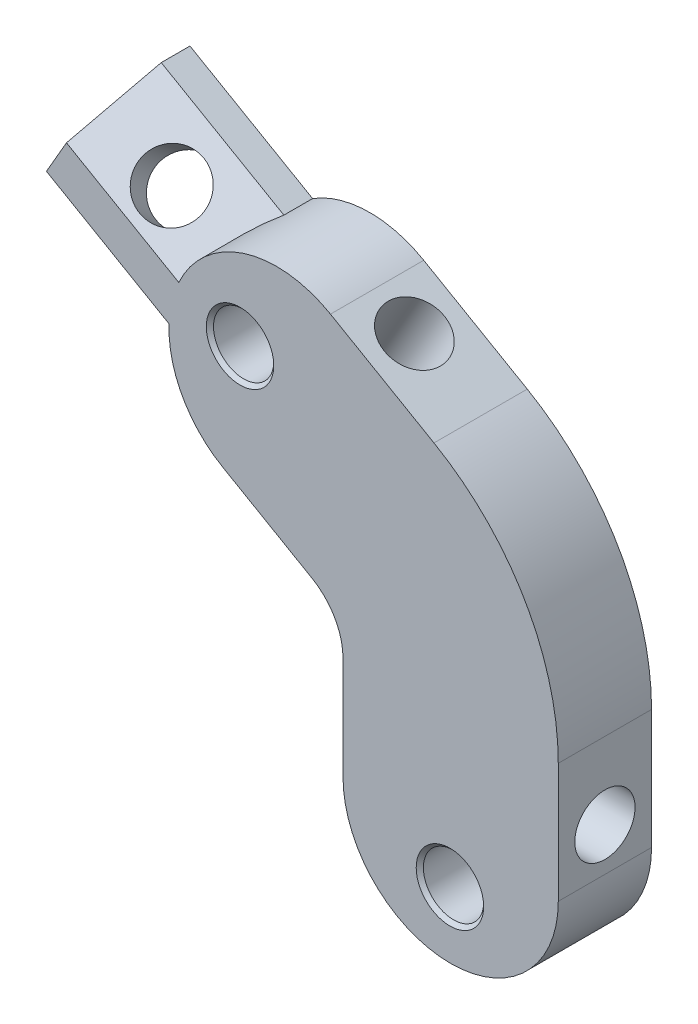
from build123d import *

# Parameters (mm, degrees)
BOSS_EXTRUDE1_DEPTH        = 13
CUT_EXTRUDE1_DEPTH         = 71.771362109
CUT_EXTRUDE2_DEPTH         = 62.040693778
F_8_4_8_4_DIAMETER_HOLE1_D = 8.4
CHAMFER2_SIZE              = 9
CHAMFER2_SIZE2             = 8.410167494
CHAMFER3_SIZE              = 8
CHAMFER3_SIZE2             = 8.56106612
SKETCH11_R                 = 4.2
CUT_EXTRUDE5_DEPTH         = 10
CHAMFER4_SIZE              = 0.5
SKETCH12_W                 = 893.834484117
SKETCH12_H                 = 134.722779032
CUT_EXTRUDE6_DEPTH         = 73.047156948


with BuildPart() as part:
    # Sketch1 → Boss-Extrude1 (new body)
    with BuildSketch(Plane(origin=(0, 0, 0), x_dir=(-1, 0, 0), z_dir=(0, 0, -1))):
        with BuildLine():
            Line((-14.999999535, -11.339745693), (-14.999999535, -27.999999731))
            ThreePointArc((-14.999999535, -27.999999731), (4.65e-07, -42.999999731), (15.000000465, -27.999999731))
            Line((15.000000465, -27.999999731), (15.000000465, -13.660253769))
            ThreePointArc((15.000000465, -13.660253769), (16.160254503, -9.33012675), (19.330127484, -6.160253769))
            Line((19.330127484, -6.160253769), (31.748711306, 1.009618943))
            ThreePointArc((31.748711306, 1.009618943), (37.239092363, 6.5), (39.248711306, 14))
            ThreePointArc((39.248711306, 14), (39.245992383, 14.285587643), (39.237836599, 14.571071754))
            Line((39.237836599, 14.571071754), (56.327549631, 24.437822174))
            Line((56.327549631, 24.437822174), (52.827549631, 30.5))
            Line((52.827549631, 30.5), (49.327549631, 36.562177826))
            Line((49.327549631, 36.562177826), (32.237836599, 26.695427407))
            ThreePointArc((32.237836599, 26.695427407), (31.994677998, 26.845232579), (31.748711306, 26.990381057))
            ThreePointArc((31.748711306, 26.990381057), (24.248711306, 29), (16.748711306, 26.990381057))
            Line((16.748711306, 26.990381057), (2.320508541, 18.660254307))
            ThreePointArc((2.320508541, 18.660254307), (-10.358983383, 5.980762382), (-14.999999535, -11.339745693))
        make_face()
    extrude(amount=-BOSS_EXTRUDE1_DEPTH)

    # Sketch2 → Cut-Extrude1 (cut, through all)
    with BuildSketch(Plane(origin=(-7.5, -12.990381057, 0), x_dir=(0.8660254037844388, -0.4999999999999997, 0), z_dir=(-0.4999999999999997, -0.8660254037844388, 0))):
        with BuildLine():
            ThreePointArc((-25.021227161, 9.417565156), (-22, 2.3), (-18.978772839, 9.417565156))
            ThreePointArc((-18.978772839, 9.417565156), (-22, 10.7), (-25.021227161, 9.417565156))
        make_face()
    extrude(amount=-CUT_EXTRUDE1_DEPTH, mode=Mode.SUBTRACT)

    # Sketch3 → Cut-Extrude2 (cut, through all)
    with BuildSketch(Plane.ZY.offset(15.000000465)):
        with BuildLine():
            ThreePointArc((9.417565156, -18.978772839), (2.3, -22), (9.417565156, -25.021227161))
            ThreePointArc((9.417565156, -25.021227161), (10.7, -22), (9.417565156, -18.978772839))
        make_face()
    extrude(amount=-CUT_EXTRUDE2_DEPTH, mode=Mode.SUBTRACT)

    # Ø8.4 (8.4) Diameter Hole1 (through all)
    with Locations(Plane(origin=(0, 0, 0), x_dir=(-1, 0, 0), z_dir=(0, 0, -1))):
        with Locations((29.347432097, 16.831243464), (0.097432097, -33.831242658)):
            Hole(F_8_4_8_4_DIAMETER_HOLE1_D / 2)

    # Chamfer2
    chamfer2_edges = [part.edges().sort_by_distance(p)[0] for p in [
        (-40.782693115, 31.628802617, 0),
    ]]
    chamfer2_side = [part.faces().sort_by_distance(p)[0] for p in [
        (-40.782693115, 31.628802617, 6.5),
    ]]
    chamfer(chamfer2_edges, length=CHAMFER2_SIZE, length2=CHAMFER2_SIZE2, reference=chamfer2_side[0])

    # Chamfer3
    chamfer3_edges = [part.edges().sort_by_distance(p)[0] for p in [
        (-47.782693115, 19.504446964, 13),
    ]]
    chamfer3_side = [part.faces().sort_by_distance(p)[0] for p in [
        (-11.809669845, -1.389258466, 13),
    ]]
    chamfer(chamfer3_edges, length=CHAMFER3_SIZE, length2=CHAMFER3_SIZE2, reference=chamfer3_side[0])

    # Sketch11 → Cut-Extrude5 (cut)
    with BuildSketch(Plane(origin=(-0.376401755, -0.651946963, 0.703467067), x_dir=(-0.9308491020683198, 0.2544179045973002, -0.2622812974630898), z_dir=(0.36532170182252927, 0.6327557486641282, -0.6827592670260799))):
        with Locations(Location((45.831104576, 22.456070648, 0), (0, 0, 89.523216635))):
            Circle(SKETCH11_R)
    extrude(amount=-CUT_EXTRUDE5_DEPTH, mode=Mode.SUBTRACT)

    # Chamfer4
    chamfer4_edges = [part.edges().sort_by_distance(p)[0] for p in [
        (-4.297432097, -33.831242658, 0),
        (-4.297432097, -33.831242658, 13),
        (-33.547432097, 16.831243464, 0),
        (-33.547432097, 16.831243464, 13),
    ]]
    chamfer(chamfer4_edges, length=CHAMFER4_SIZE)

    # Mirror1: part across plane


with BuildPart() as part_1:
    add(part.part)
    add(part.part.mirror(Plane(origin=(0, 0, 0), x_dir=(1, 0, 0), z_dir=(0, 0, -1))))

    # Sketch12 → Cut-Extrude6 (cut, through all)
    with BuildSketch(Plane(origin=(0, 0, 0), x_dir=(-1, 0, 0), z_dir=(0, 0, -1))):
        with Locations((15.524382534, -0.917202718)):
            Rectangle(SKETCH12_W, SKETCH12_H)
    extrude(amount=-CUT_EXTRUDE6_DEPTH, mode=Mode.SUBTRACT)


solid = part_1.part
